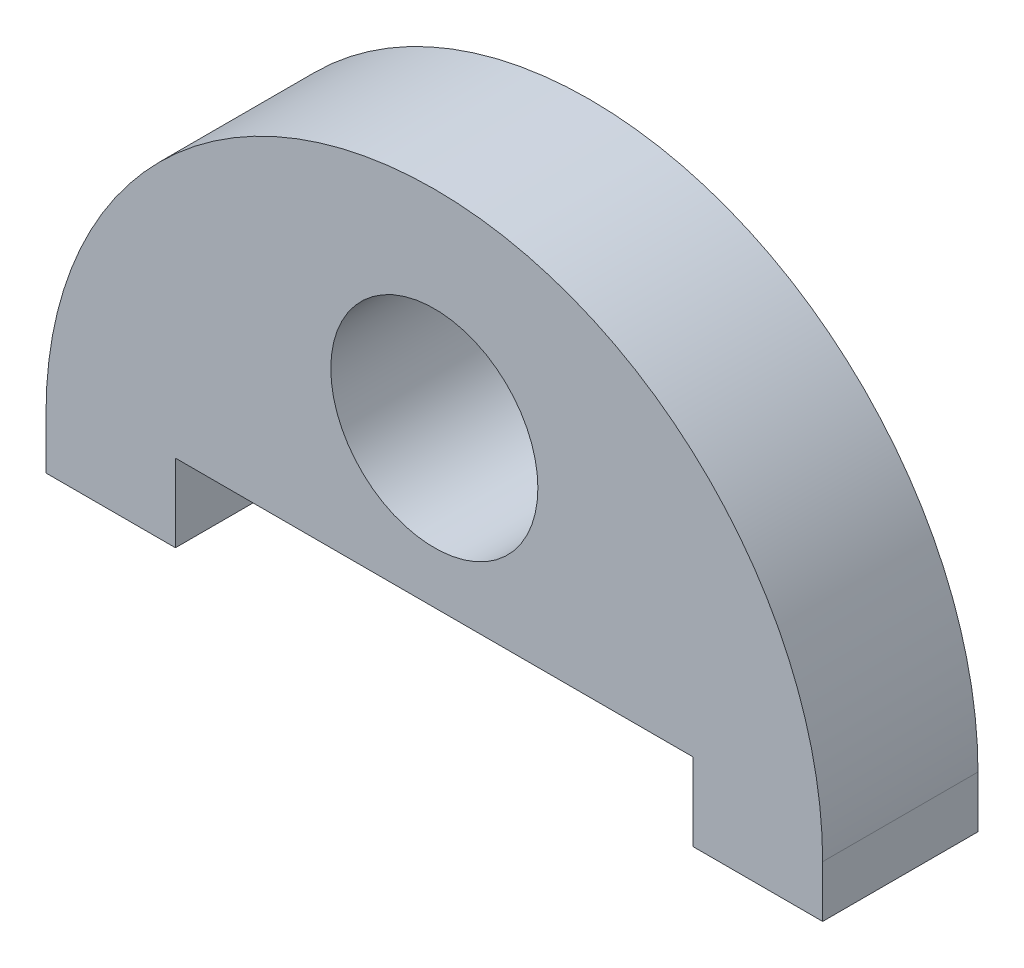
from build123d import *

# Parameters (mm, degrees)
SKETCH1_R           = 4
BOSS_EXTRUDE1_DEPTH = 6


with BuildPart() as part:
    # Sketch1 → Boss-Extrude1 (new body)
    with BuildSketch(Plane.XY):
        with BuildLine():
            Line((0, 0), (5, 0))
            Line((5, 0), (5, 3))
            Line((5, 3), (25, 3))
            Line((25, 3), (25, 0))
            Line((25, 0), (30, 0))
            Line((30, 0), (30, 2))
            ThreePointArc((30, 2), (15, 17), (0, 2))
            Line((0, 2), (0, 0))
        make_face()
        with Locations((15, 9)):
            Circle(SKETCH1_R, mode=Mode.SUBTRACT)
    extrude(amount=BOSS_EXTRUDE1_DEPTH)


solid = part.part
